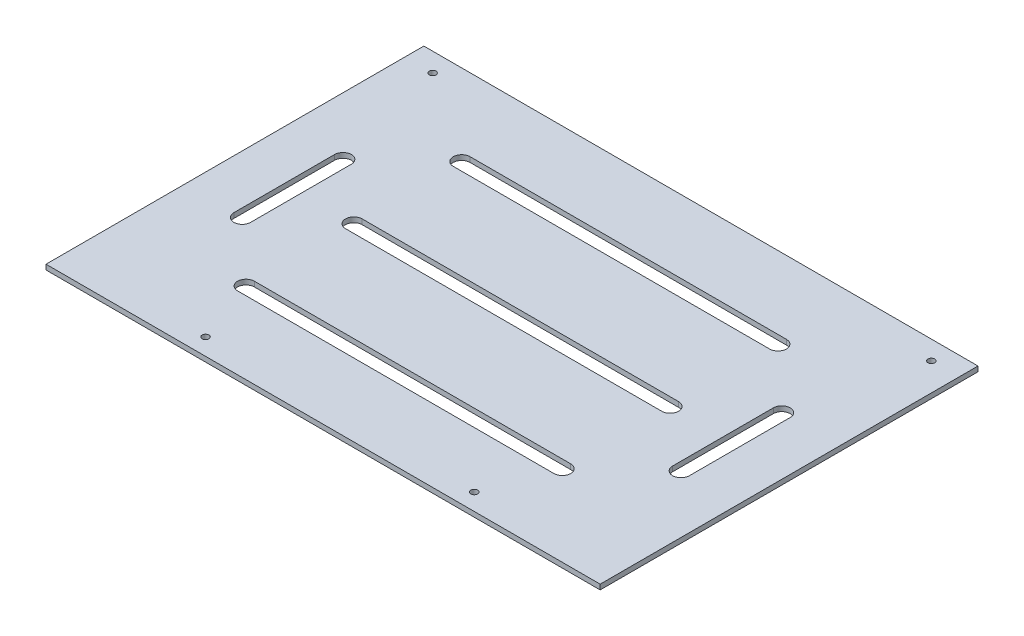
from build123d import *

# Parameters (mm, degrees)
SKETCH_1_W          = 330
SKETCH_1_H          = 225
EXTRUDE_1_DEPTH     = 3
SKETCH_3_R          = 2
CUT_EXTRUDE_1_DEPTH = 225.719219269
CUT_EXTRUDE_2_DEPTH = 225.719219269
CUT_EXTRUDE_3_DEPTH = 225.719219269
CUT_EXTRUDE_4_DEPTH = 225.719219269


with BuildPart() as part:
    # 草图1 → 凸台-拉伸1 (new body)
    with BuildSketch(Plane(origin=(0, 0, 0), x_dir=(1, 0, 0), z_dir=(0, 1, 0))):
        with Locations((19.411764706, 15.882352941)):
            Rectangle(SKETCH_1_W, SKETCH_1_H)
    extrude(amount=EXTRUDE_1_DEPTH)

    # 草图3 → 切除-拉伸1 (cut, through all)
    with BuildSketch(Plane(origin=(0, 3, 0), x_dir=(1, 0, 0), z_dir=(0, 1, 0))):
        with Locations(Location((-129.063688438, 117.115616448, 0), (0, 0, 270))):
            Circle(SKETCH_3_R)
        with Locations(Location((167.88721785, 117.115616448, 0), (0, 0, 90))):
            Circle(SKETCH_3_R)
        with Locations(Location((-60.588235294, -86.617647059, 0), (0, 0, 270))):
            Circle(SKETCH_3_R)
        with Locations(Location((99.411764706, -86.617647059, 0), (0, 0, 90))):
            Circle(SKETCH_3_R)
    extrude(amount=-CUT_EXTRUDE_1_DEPTH, mode=Mode.SUBTRACT)

    # 草图4 → 切除-拉伸2 (cut, through all)
    with BuildSketch(Plane(origin=(0, 3, 0), x_dir=(1, 0, 0), z_dir=(0, 1, 0))):
        with BuildLine():
            Line((-116.235231271, -14.117647059), (-116.235231271, 45.882352941))
            ThreePointArc((-116.235231271, 45.882352941), (-111.235231271, 50.882352941), (-106.235231271, 45.882352941))
            Line((-106.235231271, 45.882352941), (-106.235231271, -14.117647059))
            ThreePointArc((-106.235231271, -14.117647059), (-111.235231271, -19.117647059), (-116.235231271, -14.117647059))
        make_face()
        with BuildLine():
            Line((155.058760683, -14.117647059), (155.058760683, 45.882352941))
            ThreePointArc((155.058760683, 45.882352941), (150.058760683, 50.882352941), (145.058760683, 45.882352941))
            Line((145.058760683, 45.882352941), (145.058760683, -14.117647059))
            ThreePointArc((145.058760683, -14.117647059), (150.058760683, -19.117647059), (155.058760683, -14.117647059))
        make_face()
    extrude(amount=-CUT_EXTRUDE_2_DEPTH, mode=Mode.SUBTRACT)

    # 草图5 → 切除-拉伸3 (cut, through all)
    with BuildSketch(Plane(origin=(0, 3, 0), x_dir=(1, 0, 0), z_dir=(0, 1, 0))):
        with BuildLine():
            Line((-74.774602087, 85.1003303), (113.598131499, 85.1003303))
            ThreePointArc((113.598131499, 85.1003303), (118.598131499, 80.1003303), (113.598131499, 75.1003303))
            Line((113.598131499, 75.1003303), (-74.774602087, 75.1003303))
            ThreePointArc((-74.774602087, 75.1003303), (-79.774602087, 80.1003303), (-74.774602087, 85.1003303))
        make_face()
        with BuildLine():
            Line((-74.774602087, -53.335624418), (113.598131499, -53.335624418))
            ThreePointArc((113.598131499, -53.335624418), (118.598131499, -48.335624418), (113.598131499, -43.335624418))
            Line((113.598131499, -43.335624418), (-74.774602087, -43.335624418))
            ThreePointArc((-74.774602087, -43.335624418), (-79.774602087, -48.335624418), (-74.774602087, -53.335624418))
        make_face()
    extrude(amount=-CUT_EXTRUDE_3_DEPTH, mode=Mode.SUBTRACT)

    # 草图6 → 切除-拉伸4 (cut, through all)
    with BuildSketch(Plane(origin=(0, 3, 0), x_dir=(1, 0, 0), z_dir=(0, 1, 0))):
        with BuildLine():
            Line((-74.773235294, 20.882352941), (113.596764706, 20.882352941))
            ThreePointArc((113.596764706, 20.882352941), (118.596764706, 15.882352941), (113.596764706, 10.882352941))
            Line((113.596764706, 10.882352941), (-74.773235294, 10.882352941))
            ThreePointArc((-74.773235294, 10.882352941), (-79.773235294, 15.882352941), (-74.773235294, 20.882352941))
        make_face()
    extrude(amount=-CUT_EXTRUDE_4_DEPTH, mode=Mode.SUBTRACT)


solid = part.part
